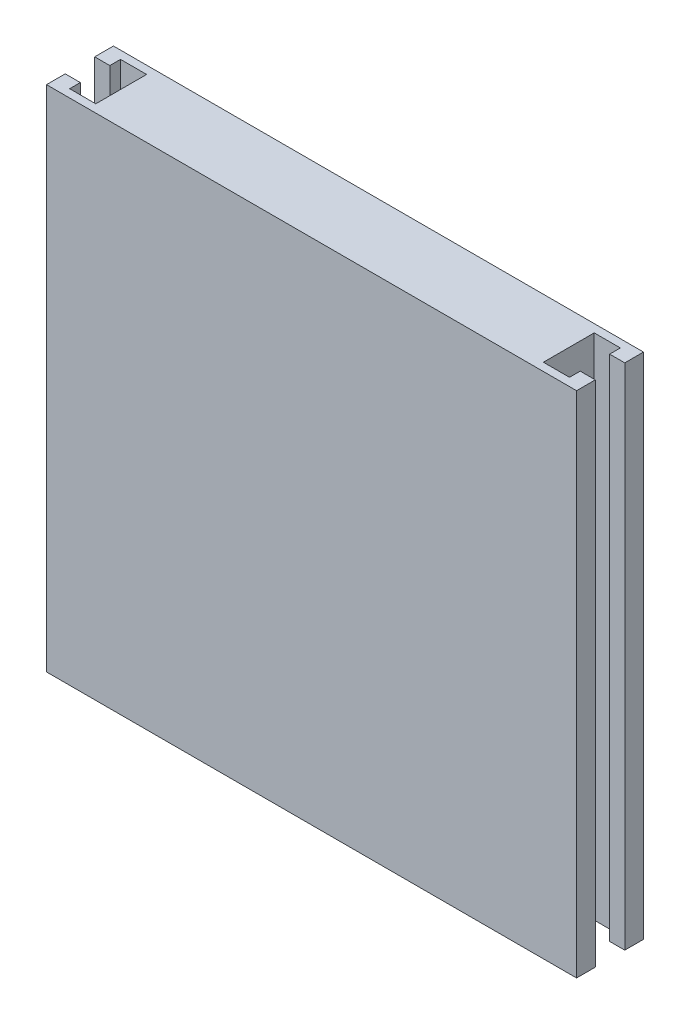
from build123d import *

# Parameters (mm, degrees)
ESTRUSIONE_ESTRUSIONE1_DEPTH = 190


with BuildPart() as part:
    # Schizzo2 → Estrusione-Estrusione1 (new body)
    with BuildSketch(Plane(origin=(0, 0, 0), x_dir=(1, 0, 0), z_dir=(0, 1, 0))):
        Polygon((415.547769121, 607.865337729), (331.895708168, 607.865337729), (322.188097577, 607.865337729), (316.547769121, 607.865337729), (316.547769121, 600.865337729), (322.188097577, 600.865337729), (322.188097577, 604.865337729), (331.948189583, 604.865337729), (331.948189583, 585.865337729), (322.188097577, 585.865337729), (322.188097577, 589.865337729), (316.547769121, 589.865337729), (316.547769121, 582.865337729), (415.547769121, 582.865337729), align=None)
    estrusione_estrusione1 = extrude(amount=ESTRUSIONE_ESTRUSIONE1_DEPTH)

    # Specchia1: Estrusione-Estrusione1 across plane
    add(estrusione_estrusione1.mirror(Plane(origin=(415.547769121, 190, 0), x_dir=(0, 0, 1), z_dir=(1, 0, 0))))


solid = part.part
